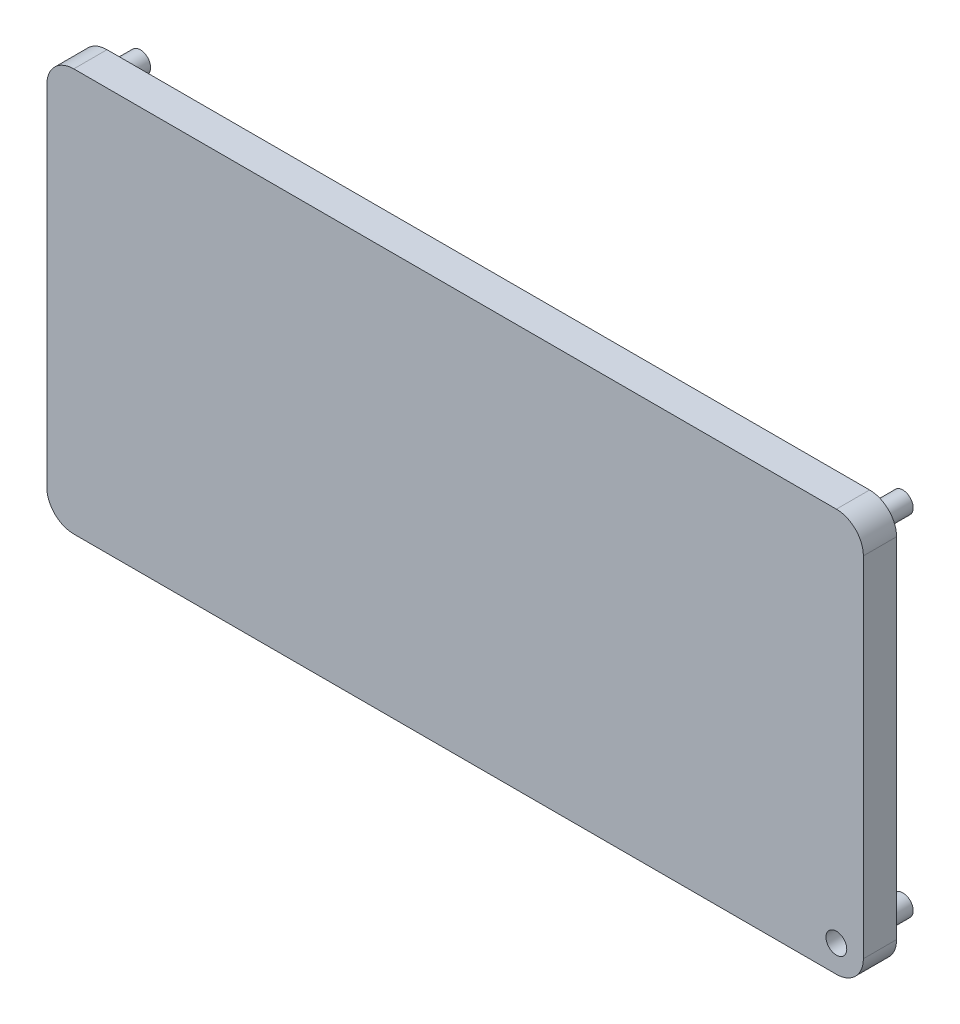
from build123d import *

# Parameters (mm, degrees)
SKETCH1_R             = 1.5875
BOSS_EXTRUDE1_DEPTH   = 5.08
BOSS_EXTRUDE1_2_DEPTH = 5.08
BOSS_EXTRUDE1_3_DEPTH = 5.08
BOSS_EXTRUDE1_4_DEPTH = 5.08
SKETCH3_R             = 1.5875
BOSS_EXTRUDE2_DEPTH   = 5.08


with BuildPart() as part:
    # Sketch1 → Boss-Extrude1 (new body)
    with BuildSketch(Plane.XY):
        with Locations((-58.297572, -26.67)):
            Circle(SKETCH1_R)
    extrude(amount=BOSS_EXTRUDE1_DEPTH)



with BuildPart() as body_2:
    # Sketch1 → Boss-Extrude1 2 (new body)
    with BuildSketch(Plane.XY):
        with Locations((-58.297572, 26.67)):
            Circle(SKETCH1_R)
    extrude(amount=BOSS_EXTRUDE1_2_DEPTH)


with BuildPart() as body_3:
    # Sketch1 → Boss-Extrude1 3 (new body)
    with BuildSketch(Plane.XY):
        with Locations((58.297572, 26.67)):
            Circle(SKETCH1_R)
    extrude(amount=BOSS_EXTRUDE1_3_DEPTH)


with BuildPart() as body_4:
    # Sketch1 → Boss-Extrude1 4 (new body)
    with BuildSketch(Plane.XY):
        with Locations((58.297572, -26.67)):
            Circle(SKETCH1_R)
    extrude(amount=BOSS_EXTRUDE1_4_DEPTH)


with BuildPart() as part_1:
    add(part.part)

    add(body_2.part)  # Boss-Extrude2 merges body 2

    add(body_3.part)  # Boss-Extrude2 merges body 3
    # Sketch3 → Boss-Extrude2 (add)
    with BuildSketch(Plane.XY.offset(5.08)):
        with BuildLine():
            Line((58.297572, 30.7975), (-58.297572, 30.7975))
            ThreePointArc((-58.297572, 30.7975), (-61.216155239, 29.588583239), (-62.425072, 26.67))
            Line((-62.425072, 26.67), (-62.425072, -26.67))
            ThreePointArc((-62.425072, -26.67), (-61.216155239, -29.588583239), (-58.297572, -30.7975))
            Line((-58.297572, -30.7975), (58.297572, -30.7975))
            ThreePointArc((58.297572, -30.7975), (61.216155239, -29.588583239), (62.425072, -26.67))
            Line((62.425072, -26.67), (62.425072, 26.67))
            ThreePointArc((62.425072, 26.67), (61.216155239, 29.588583239), (58.297572, 30.7975))
        make_face()
        with Locations((58.297572, -26.67)):
            Circle(SKETCH3_R, mode=Mode.SUBTRACT)
    extrude(amount=BOSS_EXTRUDE2_DEPTH)


solid = Compound([body_4.part, part_1.part])
